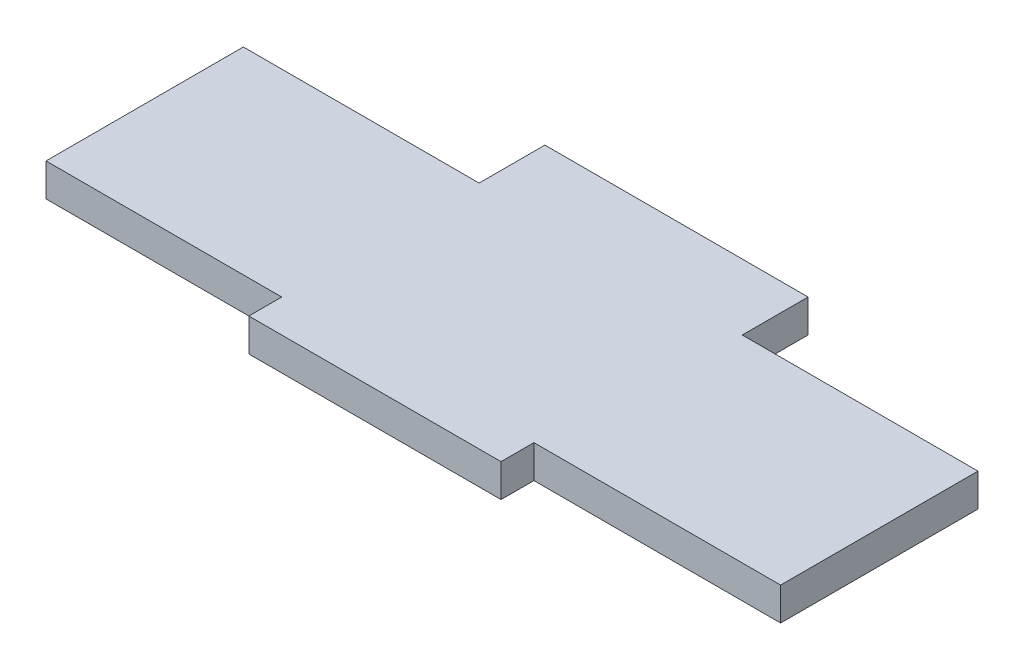
from build123d import *

# Parameters (mm, degrees)
SKETCH1_W           = 24
SKETCH1_H           = 6
SKETCH1_W_2         = 23
SKETCH1_H_2         = 3
BOSS_EXTRUDE1_DEPTH = 3


with BuildPart() as part:
    # Sketch1 → Boss-Extrude1 (new body)
    with BuildSketch(Plane(origin=(0, 0, 0), x_dir=(1, 0, 0), z_dir=(0, 1, 0))):
        Polygon((-45.497230944, 18), (-66.994461887, 18), (-66.994461887, 0), (-45.497230944, 0), (-22.497230944, 0), (-21.497230944, 0), (0, 0), (0, 18), (-21.497230944, 18), align=None)
        with Locations((-33.497230944, 21)):
            Rectangle(SKETCH1_W, SKETCH1_H)
        with Locations((-33.997230944, -1.5)):
            Rectangle(SKETCH1_W_2, SKETCH1_H_2)
    extrude(amount=BOSS_EXTRUDE1_DEPTH)


solid = part.part
